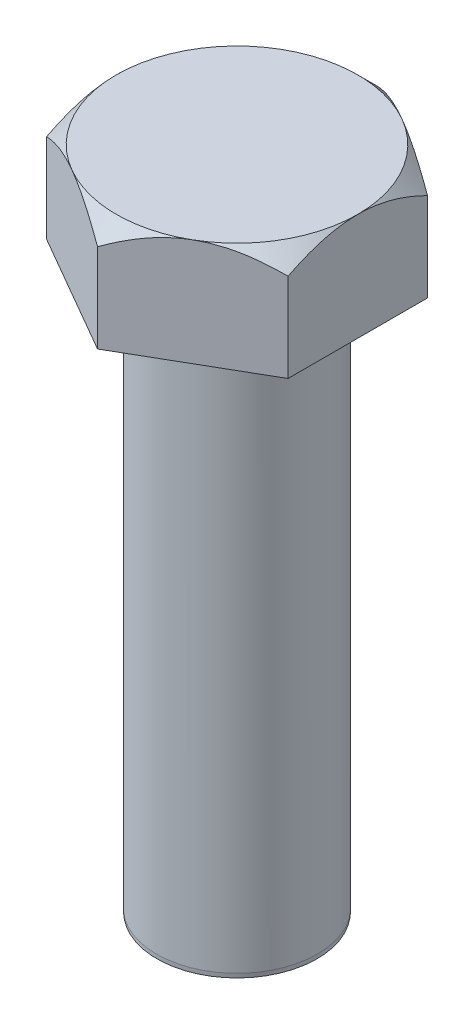
from build123d import *

# Parameters (mm, degrees)
BOSS_EXTRUDE1_DEPTH = 6.35
SKETCH2_R           = 4.7625
BOSS_EXTRUDE2_DEPTH = 33.02
SKETCH3_OUTSIDE_W   = 65.944
SKETCH3_OUTSIDE_H   = 68.156
SKETCH3_OUTSIDE_R   = 7.1501
CUT_EXTRUDE1_DEPTH  = 20.32
CUT_EXTRUDE1_DRAFT  = -45
CHAMFER1_SIZE       = 0.254
CHAMFER1_SIZE2      = 0.022222121


with BuildPart() as part:
    # Sketch1 → Boss-Extrude1 (new body)
    with BuildSketch(Plane(origin=(0, 0, 0), x_dir=(1, 0, 0), z_dir=(0, 1, 0))):
        Polygon((0, 8.256224319), (-7.1501, 4.12811216), (-7.1501, -4.12811216), (0, -8.256224319), (7.1501, -4.12811216), (7.1501, 4.12811216), align=None)
    extrude(amount=BOSS_EXTRUDE1_DEPTH)

    # Sketch2 → Boss-Extrude2 (add)
    with BuildSketch(Plane.XZ):
        with Locations(Location((0, 0, 0), (0, 0, 90))):
            Circle(SKETCH2_R)
    extrude(amount=BOSS_EXTRUDE2_DEPTH)


with BuildPart() as cut_extrude1_tool:
    # Sketch3 outside → Cut-Extrude1 (with draft: the straight prism first)
    with BuildSketch(Plane(origin=(0, 6.35, 0), x_dir=(1, 0, 0), z_dir=(0, 1, 0))):
        Rectangle(SKETCH3_OUTSIDE_W, SKETCH3_OUTSIDE_H)
        Circle(SKETCH3_OUTSIDE_R, mode=Mode.SUBTRACT)
    extrude(amount=-CUT_EXTRUDE1_DEPTH)
    # Cut-Extrude1: the draft: its side faces are tilted about the plane it starts from
    cut_extrude1_sides = [cut_extrude1_tool.faces().sort_by_distance(p)[0] for p in [
        (0, -3.81, 34.078),
        (32.972, -3.81, 0),
        (0, -3.81, -34.078),
        (-32.972, -3.81, 0),
        (-7.1501, -3.81, 0),
    ]]
    draft(cut_extrude1_sides, Plane(origin=(0, 6.35, 0), x_dir=(1, 0, 0), z_dir=(0, 1, 0)), CUT_EXTRUDE1_DRAFT)


with BuildPart() as part_1:
    add(part.part)

    # Cut-Extrude1: cut by cut_extrude1_tool
    add(cut_extrude1_tool.part, mode=Mode.SUBTRACT)

    # Chamfer1
    chamfer1_edges = [part_1.edges().sort_by_distance(p)[0] for p in [
        (0, -33.02, -4.7625),
    ]]
    chamfer1_side = [part_1.faces().sort_by_distance(p)[0] for p in [
        (0, -16.51, -4.7625),
    ]]
    chamfer(chamfer1_edges, length=CHAMFER1_SIZE, length2=CHAMFER1_SIZE2, reference=chamfer1_side[0])


solid = part_1.part
